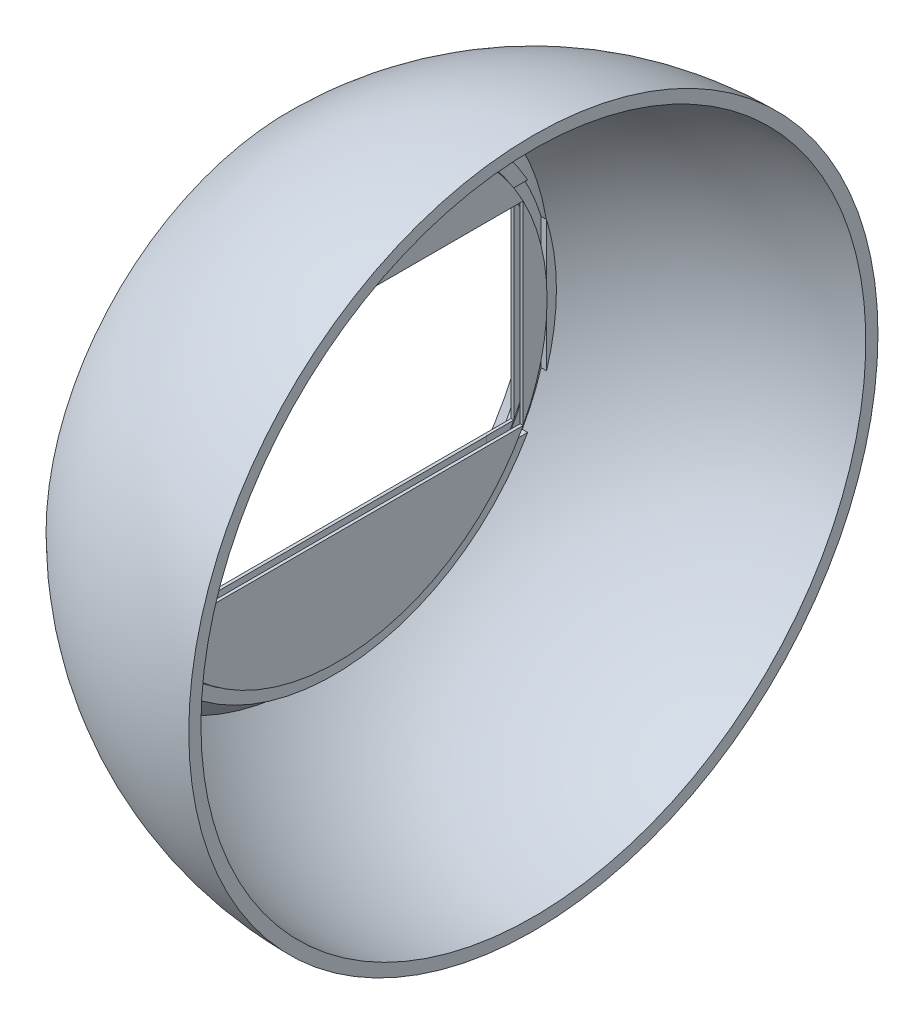
from build123d import *

# Parameters (mm, degrees)
BOSS_EXTRUDE1_DEPTH   = 2
BOSS_EXTRUDE1_2_DEPTH = 2
BOSS_EXTRUDE1_3_DEPTH = 2
BOSS_EXTRUDE1_4_DEPTH = 2
SKETCH9_W             = 1
SKETCH9_H             = 61
CUT_EXTRUDE1_DEPTH    = 2
SKETCH10_W            = 1
SKETCH10_H            = 61
CUT_EXTRUDE2_DEPTH    = 2
SKETCH12_W            = 1
SKETCH12_H            = 36
CUT_EXTRUDE3_DEPTH    = 2
SKETCH13_W            = 1
SKETCH13_H            = 36
CUT_EXTRUDE8_DEPTH    = 4.5


with BuildPart() as part:
    # Sketch1 → Revolve1 (revolve)
    with BuildSketch(Plane.XY, mode=Mode.PRIVATE) as revolve1_sk:
        with BuildLine():
            Line((-40.206859547, 40), (-34.828674339, 34.621814792))
            Line((-34.828674339, 34.621814792), (-32.828674339, 34.621814792))
            Line((-32.828674339, 34.621814792), (-32.828674339, 36.621814792))
            Line((-32.828674339, 36.621814792), (-34.000247215, 36.621814792))
            Line((-34.000247215, 36.621814792), (-37.356354939, 39.977922516))
            ThreePointArc((-37.356354939, 39.977922516), (-20.079086089, 50.897562268), (0, 54.715002906))
            Line((0, 54.715002906), (0, 56.715002906))
            ThreePointArc((0, 56.715002906), (-21.771442745, 52.369798887), (-40.206859547, 40))
        make_face()
    revolve(revolve1_sk.sketch.rotate(Axis((-112.648728237, 0, 0), (1, 0, 0)), 90), axis=Axis((-112.648728237, 0, 0), (1, 0, 0)))


with BuildPart() as body_2:
    # Sketch7 → Boss-Extrude1 (new body)
    with BuildSketch(Plane(origin=(-34.185, 0, 0), x_dir=(0, 0, -1), z_dir=(1, 0, 0))):
        with BuildLine():
            ThreePointArc((30.5, 16), (0, 34.441980199), (-30.5, 16))
            Line((-30.5, 16), (30.5, 16))
        make_face()
    extrude(amount=BOSS_EXTRUDE1_DEPTH)


with BuildPart() as body_3:
    # Sketch7 → Boss-Extrude1 2 (new body)
    with BuildSketch(Plane(origin=(-34.185, 0, 0), x_dir=(0, 0, -1), z_dir=(1, 0, 0))):
        with BuildLine():
            Line((-30.5, -16), (-30.5, 16))
            ThreePointArc((-30.5, 16), (-34.441980199, 0), (-30.5, -16))
        make_face()
    extrude(amount=BOSS_EXTRUDE1_2_DEPTH)


with BuildPart() as body_4:
    # Sketch7 → Boss-Extrude1 3 (new body)
    with BuildSketch(Plane(origin=(-34.185, 0, 0), x_dir=(0, 0, -1), z_dir=(1, 0, 0))):
        with BuildLine():
            Line((30.5, -16), (-30.5, -16))
            ThreePointArc((-30.5, -16), (0, -34.441980199), (30.5, -16))
        make_face()
    extrude(amount=BOSS_EXTRUDE1_3_DEPTH)


with BuildPart() as body_5:
    # Sketch7 → Boss-Extrude1 4 (new body)
    with BuildSketch(Plane(origin=(-34.185, 0, 0), x_dir=(0, 0, -1), z_dir=(1, 0, 0))):
        with BuildLine():
            ThreePointArc((34.441980199, 0), (33.441967616, 8.239223384), (30.5, 16))
            Line((30.5, 16), (30.5, -16))
            ThreePointArc((30.5, -16), (33.441967616, -8.239223384), (34.441980199, 0))
        make_face()
    extrude(amount=BOSS_EXTRUDE1_4_DEPTH)


with BuildPart() as cut_extrude1_tool:
    # Sketch9 → Cut-Extrude1 (new body)
    with BuildSketch(Plane.XZ.offset(-16)):
        with Locations((-33.185, 0)):
            Rectangle(SKETCH9_W, SKETCH9_H)
    extrude(amount=-CUT_EXTRUDE1_DEPTH)


with BuildPart() as part_1:
    add(part.part)

    # Cut-Extrude1: cut by cut_extrude1_tool
    add(cut_extrude1_tool.part, mode=Mode.SUBTRACT)


with BuildPart() as body_2_1:
    add(body_2.part)

    # Cut-Extrude1: cut by cut_extrude1_tool
    add(cut_extrude1_tool.part, mode=Mode.SUBTRACT)


with BuildPart() as cut_extrude2_tool:
    # Sketch10 → Cut-Extrude2 (new body)
    with BuildSketch(Plane(origin=(0, -16, 0), x_dir=(1, 0, 0), z_dir=(0, 1, 0))):
        with Locations((-33.185, 0)):
            Rectangle(SKETCH10_W, SKETCH10_H)
    extrude(amount=-CUT_EXTRUDE2_DEPTH)


with BuildPart() as part_2:
    add(part_1.part)

    # Cut-Extrude2: cut by cut_extrude2_tool
    add(cut_extrude2_tool.part, mode=Mode.SUBTRACT)


with BuildPart() as body_4_1:
    add(body_4.part)

    # Cut-Extrude2: cut by cut_extrude2_tool
    add(cut_extrude2_tool.part, mode=Mode.SUBTRACT)


with BuildPart() as cut_extrude3_tool:
    # Sketch12 → Cut-Extrude3 (new body)
    with BuildSketch(Plane(origin=(0, 0, 30.5), x_dir=(-1, 0, 0), z_dir=(0, 0, -1))):
        with Locations((33.185, 0)):
            Rectangle(SKETCH12_W, SKETCH12_H)
    extrude(amount=-CUT_EXTRUDE3_DEPTH)


with BuildPart() as part_3:
    add(part_2.part)

    # Cut-Extrude3: cut by cut_extrude3_tool
    add(cut_extrude3_tool.part, mode=Mode.SUBTRACT)


with BuildPart() as body_3_1:
    add(body_3.part)

    # Cut-Extrude3: cut by cut_extrude3_tool
    add(cut_extrude3_tool.part, mode=Mode.SUBTRACT)


with BuildPart() as cut_extrude8_tool:
    # Sketch13 → Cut-Extrude8 (new, symmetric)
    with BuildSketch(Plane.XY.offset(-30.5)):
        with Locations((-33.225443476, 0)):
            Rectangle(SKETCH13_W, SKETCH13_H)
    extrude(amount=CUT_EXTRUDE8_DEPTH, both=True)


with BuildPart() as part_4:
    add(part_3.part)

    # Cut-Extrude8: cut by cut_extrude8_tool
    add(cut_extrude8_tool.part, mode=Mode.SUBTRACT)


with BuildPart() as body_2_2:
    add(body_2_1.part)

    # Cut-Extrude8: cut by cut_extrude8_tool
    add(cut_extrude8_tool.part, mode=Mode.SUBTRACT)


with BuildPart() as body_4_2:
    add(body_4_1.part)

    # Cut-Extrude8: cut by cut_extrude8_tool
    add(cut_extrude8_tool.part, mode=Mode.SUBTRACT)


with BuildPart() as body_5_1:
    add(body_5.part)

    # Cut-Extrude8: cut by cut_extrude8_tool
    add(cut_extrude8_tool.part, mode=Mode.SUBTRACT)


solid = Compound([body_3_1.part, part_4.part, body_2_2.part, body_4_2.part, body_5_1.part])
